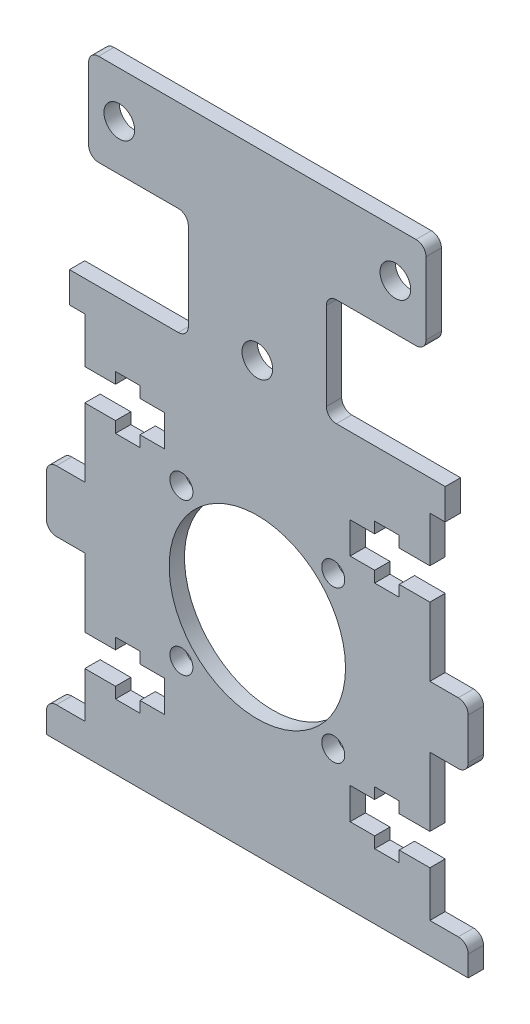
from build123d import *

# Parameters (mm, degrees)
SKETCH_1_R          = 1.5
SKETCH_1_R_2        = 11.5
SKETCH_1_R_3        = 2
EXTRUDE_1_DEPTH     = 2
FILLET_1_R          = 1.3
SKETCH_4_W          = 3
SKETCH_4_H          = 5.878615105
SKETCH_4_H_2        = 11.344283934
CUT_EXTRUDE_1_DEPTH = 2


with BuildPart() as part:
    # 草图1 → 凸台-拉伸1 (new body)
    with BuildSketch(Plane.XY):
        Polygon((22.5, -27), (-22.5, -27), (-27.5, -27), (-27.5, -23), (-22.5, -23), (-22.5, -17.05), (-18.5, -17.05), (-18.5, -18.5), (-15.3, -18.5), (-15.3, -17.05), (-12.1, -17.05), (-12.1, -12.95), (-15.3, -12.95), (-15.3, -11.5), (-18.5, -11.5), (-18.5, -12.95), (-22.5, -12.95), (-22.5, -4), (-27.5, -4), (-27.5, 4), (-22.5, 4), (-22.5, 12.95), (-18.5, 12.95), (-18.5, 11.5), (-15.3, 11.5), (-15.3, 12.95), (-12.1, 12.95), (-12.1, 17.05), (-15.3, 17.05), (-15.3, 18.5), (-18.5, 18.5), (-18.5, 17.05), (-22.5, 17.05), (-22.5, 23), (-27.5, 23), (-27.5, 27), (-22.5, 27), (-9, 27), (-9, 41), (-22, 41), (-22, 53), (22, 53), (22, 41), (9, 41), (9, 27), (22.5, 27), (27.5, 27), (27.5, 23), (22.5, 23), (22.5, 17.05), (18.5, 17.05), (18.5, 18.5), (15.3, 18.5), (15.3, 17.05), (12.1, 17.05), (12.1, 12.95), (15.3, 12.95), (15.3, 11.5), (18.5, 11.5), (18.5, 12.95), (22.5, 12.95), (22.5, 4), (27.5, 4), (27.5, -4), (22.5, -4), (22.5, -12.95), (18.5, -12.95), (18.5, -11.5), (15.3, -11.5), (15.3, -12.95), (12.1, -12.95), (12.1, -17.05), (15.3, -17.05), (15.3, -18.5), (18.5, -18.5), (18.5, -17.05), (22.5, -17.05), (22.5, -23), (27.5, -23), (27.5, -27), align=None)
        with Locations((9.899494937, 9.899494937)):
            Circle(SKETCH_1_R, mode=Mode.SUBTRACT)
        Circle(SKETCH_1_R_2, mode=Mode.SUBTRACT)
        with Locations((9.899494937, -9.899494937)):
            Circle(SKETCH_1_R, mode=Mode.SUBTRACT)
        with Locations((-9.899494937, -9.899494937)):
            Circle(SKETCH_1_R, mode=Mode.SUBTRACT)
        with Locations((-9.899494937, 9.899494937)):
            Circle(SKETCH_1_R, mode=Mode.SUBTRACT)
        with Locations((-18, 47)):
            Circle(SKETCH_1_R_3, mode=Mode.SUBTRACT)
        with Locations((18, 47)):
            Circle(SKETCH_1_R_3, mode=Mode.SUBTRACT)
        with Locations((0, 29)):
            Circle(SKETCH_1_R_3, mode=Mode.SUBTRACT)
    extrude(amount=EXTRUDE_1_DEPTH)

    # 圆角1
    fillet_1_edges = [part.edges().sort_by_distance(p)[0] for p in [
        (-9, 27, 1),
        (-9, 41, 1),
        (-22, 41, 1),
        (-22, 53, 1),
        (22, 53, 1),
        (22, 41, 1),
        (9, 41, 1),
        (9, 27, 1),
        (27.5, 23, 1),
        (27.5, 4, 1),
        (27.5, -4, 1),
        (27.5, -23, 1),
        (-27.5, -23, 1),
        (-27.5, -4, 1),
        (-27.5, 4, 1),
        (-27.5, 23, 1),
    ]]
    fillet(fillet_1_edges, radius=FILLET_1_R)

    # 草图4 → 切除-拉伸1 (cut)
    with BuildSketch(Plane.XY.offset(2)):
        with Locations((26, 24.060692448)):
            Rectangle(SKETCH_4_W, SKETCH_4_H)
        with Locations((-26, 21.327858033)):
            Rectangle(SKETCH_4_W, SKETCH_4_H_2)
    extrude(amount=-CUT_EXTRUDE_1_DEPTH, mode=Mode.SUBTRACT)


solid = part.part
